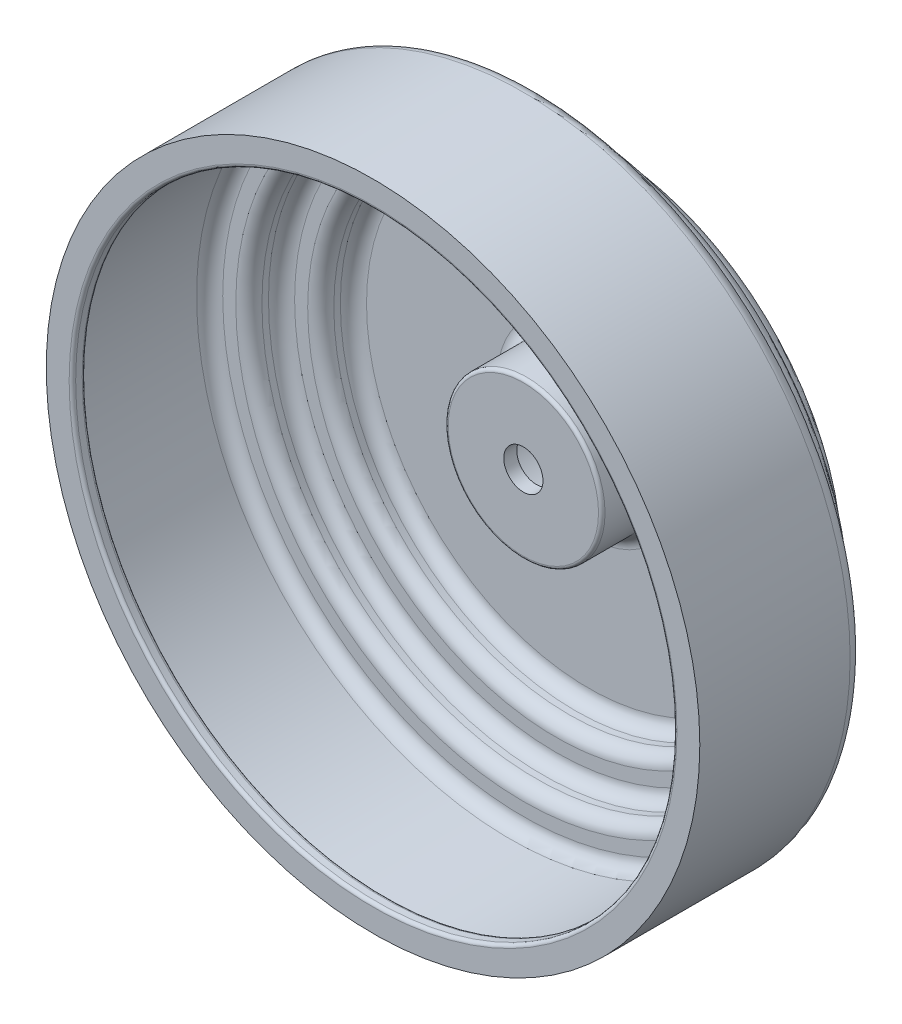
from build123d import *

# Parameters (mm, degrees)
FILLET1_R = 2
FILLET2_R = 0.5


with BuildPart() as part:
    # Sketch1 → Revolve1 (revolve)
    with BuildSketch(Plane.YZ):
        Polygon((-50, 35), (-50, 10), (-44, 10), (-44, 5), (-38, 5), (-38, 0), (-10, 0), (-10, 10), (-3, 10), (-3, 12), (-12, 12), (-12, 2), (-36, 2), (-36, 7), (-42, 7), (-42, 12), (-48, 12), (-48, 33), (-46, 33), (-46, 35), align=None)
    revolve(axis=Axis((0, 0, 39.266475796), (0, 0, -1)))

    # Fillet1
    fillet1_edges = [part.edges().sort_by_distance(p)[0] for p in [
        (0, 50, 10),
        (0, 44, 10),
        (0, 44, 5),
        (0, 38, 5),
        (0, 38, 0),
        (0, 48, 12),
        (0, 42, 12),
        (0, 42, 7),
        (0, 36, 7),
        (0, 36, 2),
        (0, 12, 2),
    ]]
    fillet(fillet1_edges, radius=FILLET1_R)

    # Fillet2
    fillet2_edges = [part.edges().sort_by_distance(p)[0] for p in [
        (0, 12, 12),
        (0, 46, 35),
        (0, 46, 33),
        (0, 10, 0),
    ]]
    fillet(fillet2_edges, radius=FILLET2_R)


solid = part.part
